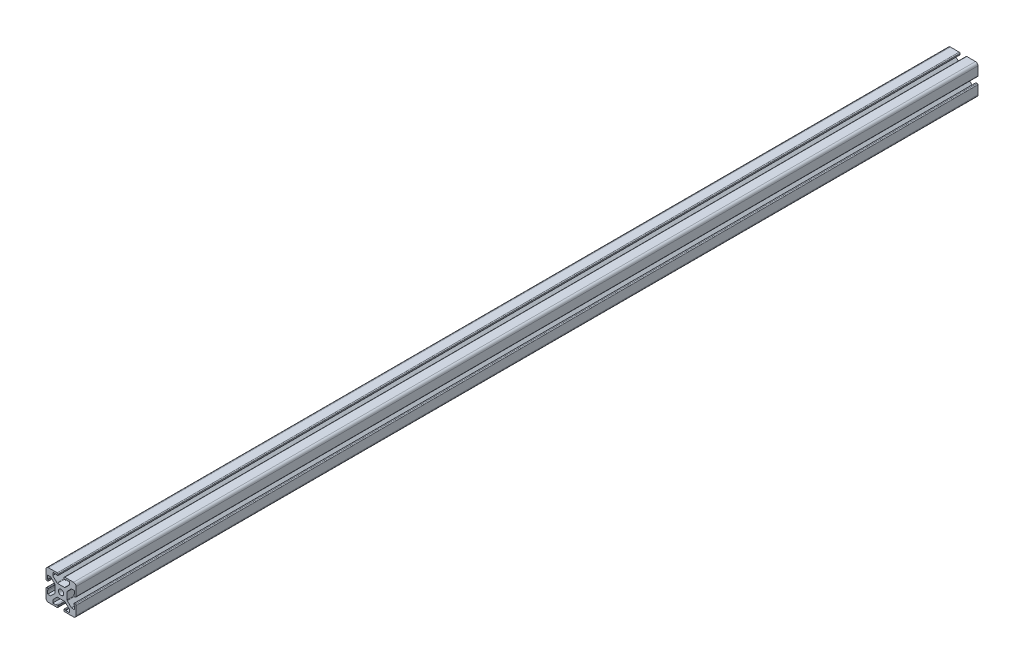
from build123d import *

# Parameters (mm, degrees)
SKETCH1_R           = 3.5
BOSS_EXTRUDE1_DEPTH = 600


with BuildPart() as part:
    # Sketch1 → Boss-Extrude1 (new, symmetric)
    with BuildSketch(Plane.XY):
        with BuildLine():
            Line((-8, 4.600266817), (-8, -4.600266817))
            ThreePointArc((-8, -4.600266817), (-8.096672994, -5.086274776), (-8.371974388, -5.498292429))
            Line((-8.371974388, -5.498292429), (-13.873681959, -11))
            Line((-13.873681959, -11), (-17.7902, -11))
            Line((-17.7902, -11), (-17.7902, -6.2098))
            Line((-17.7902, -6.2098), (-17.0282, -6.2098))
            Line((-17.0282, -6.2098), (-17.0282, -4.508))
            ThreePointArc((-17.0282, -4.508), (-17.176989755, -4.148789755), (-17.5362, -4))
            Line((-17.5362, -4), (-18.8951, -4))
            ThreePointArc((-18.8951, -4), (-19.676382283, -4.323617717), (-20, -5.1049))
            Line((-20, -5.1049), (-20, -16.68))
            ThreePointArc((-20, -16.68), (-19.027594514, -19.027594514), (-16.68, -20))
            Line((-16.68, -20), (-5.1049, -20))
            ThreePointArc((-5.1049, -20), (-4.323617717, -19.676382283), (-4, -18.8951))
            Line((-4, -18.8951), (-4, -17.5362))
            ThreePointArc((-4, -17.5362), (-4.148789755, -17.176989755), (-4.508, -17.0282))
            Line((-4.508, -17.0282), (-6.2098, -17.0282))
            Line((-6.2098, -17.0282), (-6.2098, -17.7902))
            Line((-6.2098, -17.7902), (-11, -17.7902))
            Line((-11, -17.7902), (-11, -13.873681959))
            Line((-11, -13.873681959), (-5.498292429, -8.371974388))
            ThreePointArc((-5.498292429, -8.371974388), (-5.086274776, -8.096672994), (-4.600266817, -8))
            Line((-4.600266817, -8), (4.600266817, -8))
            ThreePointArc((4.600266817, -8), (5.086274776, -8.096672994), (5.498292429, -8.371974388))
            Line((5.498292429, -8.371974388), (11, -13.873681959))
            Line((11, -13.873681959), (11, -17.7902))
            Line((11, -17.7902), (6.2098, -17.7902))
            Line((6.2098, -17.7902), (6.2098, -17.0282))
            Line((6.2098, -17.0282), (4.508, -17.0282))
            ThreePointArc((4.508, -17.0282), (4.148789755, -17.176989755), (4, -17.5362))
            Line((4, -17.5362), (4, -18.8951))
            ThreePointArc((4, -18.8951), (4.323617717, -19.676382283), (5.1049, -20))
            Line((5.1049, -20), (16.68, -20))
            ThreePointArc((16.68, -20), (19.027594514, -19.027594514), (20, -16.68))
            Line((20, -16.68), (20, -5.1049))
            ThreePointArc((20, -5.1049), (19.676382283, -4.323617717), (18.8951, -4))
            Line((18.8951, -4), (17.5362, -4))
            ThreePointArc((17.5362, -4), (17.176989755, -4.148789755), (17.0282, -4.508))
            Line((17.0282, -4.508), (17.0282, -6.2098))
            Line((17.0282, -6.2098), (17.7902, -6.2098))
            Line((17.7902, -6.2098), (17.7902, -11))
            Line((17.7902, -11), (13.873681959, -11))
            Line((13.873681959, -11), (8.371974388, -5.498292429))
            ThreePointArc((8.371974388, -5.498292429), (8.096672994, -5.086274776), (8, -4.600266817))
            Line((8, -4.600266817), (8, 4.600266817))
            ThreePointArc((8, 4.600266817), (8.096672994, 5.086274776), (8.371974388, 5.498292429))
            Line((8.371974388, 5.498292429), (13.873681959, 11))
            Line((13.873681959, 11), (17.7902, 11))
            Line((17.7902, 11), (17.7902, 6.2098))
            Line((17.7902, 6.2098), (17.0282, 6.2098))
            Line((17.0282, 6.2098), (17.0282, 4.508))
            ThreePointArc((17.0282, 4.508), (17.176989755, 4.148789755), (17.5362, 4))
            Line((17.5362, 4), (18.8951, 4))
            ThreePointArc((18.8951, 4), (19.676382283, 4.323617717), (20, 5.1049))
            Line((20, 5.1049), (20, 16.68))
            ThreePointArc((20, 16.68), (19.027594514, 19.027594514), (16.68, 20))
            Line((16.68, 20), (5.1049, 20))
            ThreePointArc((5.1049, 20), (4.323617717, 19.676382283), (4, 18.8951))
            Line((4, 18.8951), (4, 17.5362))
            ThreePointArc((4, 17.5362), (4.148789755, 17.176989755), (4.508, 17.0282))
            Line((4.508, 17.0282), (6.2098, 17.0282))
            Line((6.2098, 17.0282), (6.2098, 17.7902))
            Line((6.2098, 17.7902), (11, 17.7902))
            Line((11, 17.7902), (11, 13.873681959))
            Line((11, 13.873681959), (5.498292429, 8.371974388))
            ThreePointArc((5.498292429, 8.371974388), (5.086274776, 8.096672994), (4.600266817, 8))
            Line((4.600266817, 8), (-4.600266817, 8))
            ThreePointArc((-4.600266817, 8), (-5.086274776, 8.096672994), (-5.498292429, 8.371974388))
            Line((-5.498292429, 8.371974388), (-11, 13.873681959))
            Line((-11, 13.873681959), (-11, 17.7902))
            Line((-11, 17.7902), (-6.2098, 17.7902))
            Line((-6.2098, 17.7902), (-6.2098, 17.0282))
            Line((-6.2098, 17.0282), (-4.508, 17.0282))
            ThreePointArc((-4.508, 17.0282), (-4.148789755, 17.176989755), (-4, 17.5362))
            Line((-4, 17.5362), (-4, 18.8951))
            ThreePointArc((-4, 18.8951), (-4.323617717, 19.676382283), (-5.1049, 20))
            Line((-5.1049, 20), (-16.68, 20))
            ThreePointArc((-16.68, 20), (-19.027594514, 19.027594514), (-20, 16.68))
            Line((-20, 16.68), (-20, 5.1049))
            ThreePointArc((-20, 5.1049), (-19.676382283, 4.323617717), (-18.8951, 4))
            Line((-18.8951, 4), (-17.5362, 4))
            ThreePointArc((-17.5362, 4), (-17.176989755, 4.148789755), (-17.0282, 4.508))
            Line((-17.0282, 4.508), (-17.0282, 6.2098))
            Line((-17.0282, 6.2098), (-17.7902, 6.2098))
            Line((-17.7902, 6.2098), (-17.7902, 11))
            Line((-17.7902, 11), (-13.873681959, 11))
            Line((-13.873681959, 11), (-8.371974388, 5.498292429))
            ThreePointArc((-8.371974388, 5.498292429), (-8.096672994, 5.086274776), (-8, 4.600266817))
        make_face()
        Circle(SKETCH1_R, mode=Mode.SUBTRACT)
    extrude(amount=BOSS_EXTRUDE1_DEPTH, both=True)


solid = part.part
